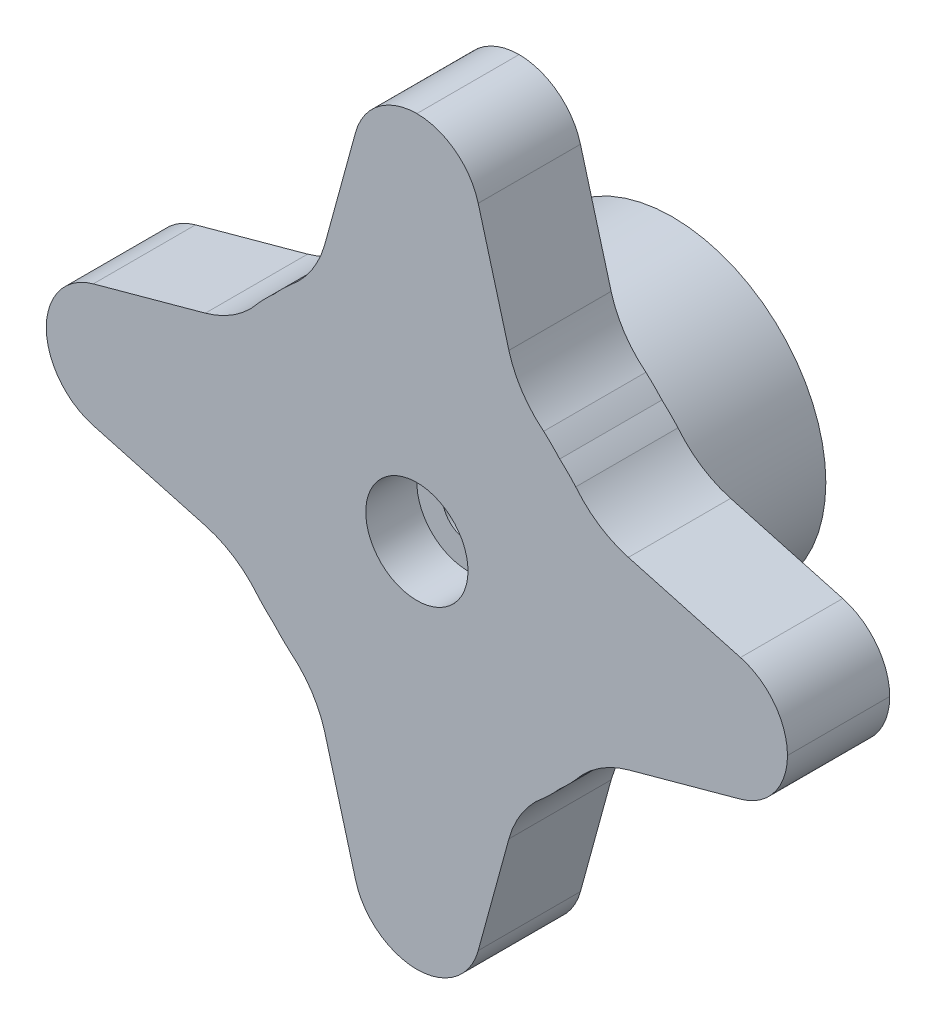
from build123d import *

# Parameters (mm, degrees)
BOSS_EXTRUDE1_DEPTH = 2
SKETCH2_R           = 3
SKETCH2_R_2         = 2.5
BOSS_EXTRUDE2_DEPTH = 3
SKETCH3_R           = 1
CUT_EXTRUDE1_DEPTH  = 1
SKETCH4_R           = 0.5
CUT_EXTRUDE2_DEPTH  = 1


with BuildPart() as part:
    # Sketch1 → Boss-Extrude1 (new body)
    with BuildSketch(Plane.XY):
        with BuildLine():
            Line((1.2, -6.33), (1.8, -4.1378116))
            ThreePointArc((1.8, -4.1378116), (2.058560194, -3.569045514), (2.48, -3.1078116))
            ThreePointArc((2.48, -3.1078116), (2.641475661, -2.955390865), (2.794244497, -2.794244497))
            ThreePointArc((2.794244497, -2.794244497), (2.955390865, -2.641475661), (3.1078116, -2.48))
            ThreePointArc((3.1078116, -2.48), (3.569045514, -2.058560194), (4.1378116, -1.8))
            Line((4.1378116, -1.8), (6.33, -1.2))
            ThreePointArc((6.33, -1.2), (6.992020752, -0.754882576), (7.25, 0))
            ThreePointArc((7.25, 0), (6.992020752, 0.754882576), (6.33, 1.2))
            Line((6.33, 1.2), (4.1378116, 1.8))
            ThreePointArc((4.1378116, 1.8), (3.569045514, 2.058560194), (3.1078116, 2.48))
            ThreePointArc((3.1078116, 2.48), (2.955390865, 2.641475661), (2.794244497, 2.794244497))
            ThreePointArc((2.794244497, 2.794244497), (2.641475661, 2.955390865), (2.48, 3.1078116))
            ThreePointArc((2.48, 3.1078116), (2.058560194, 3.569045514), (1.8, 4.1378116))
            Line((1.8, 4.1378116), (1.2, 6.33))
            ThreePointArc((1.2, 6.33), (0.754882576, 6.992020752), (0, 7.25))
            ThreePointArc((0, 7.25), (-0.754882576, 6.992020752), (-1.2, 6.33))
            Line((-1.2, 6.33), (-1.8, 4.1378116))
            ThreePointArc((-1.8, 4.1378116), (-2.058560194, 3.569045514), (-2.48, 3.1078116))
            ThreePointArc((-2.48, 3.1078116), (-2.641475661, 2.955390865), (-2.794244497, 2.794244497))
            ThreePointArc((-2.794244497, 2.794244497), (-2.955390865, 2.641475661), (-3.1078116, 2.48))
            ThreePointArc((-3.1078116, 2.48), (-3.569045514, 2.058560194), (-4.1378116, 1.8))
            Line((-4.1378116, 1.8), (-6.33, 1.2))
            ThreePointArc((-6.33, 1.2), (-6.992020752, 0.754882576), (-7.25, 0))
            ThreePointArc((-7.25, 0), (-6.992020752, -0.754882576), (-6.33, -1.2))
            Line((-6.33, -1.2), (-4.1378116, -1.8))
            ThreePointArc((-4.1378116, -1.8), (-3.569045514, -2.058560194), (-3.1078116, -2.48))
            ThreePointArc((-3.1078116, -2.48), (-2.955390865, -2.641475661), (-2.794244497, -2.794244497))
            ThreePointArc((-2.794244497, -2.794244497), (-2.641475661, -2.955390865), (-2.48, -3.1078116))
            ThreePointArc((-2.48, -3.1078116), (-2.058560194, -3.569045514), (-1.8, -4.1378116))
            Line((-1.8, -4.1378116), (-1.2, -6.33))
            ThreePointArc((-1.2, -6.33), (-0.754882576, -6.992020752), (0, -7.25))
            ThreePointArc((0, -7.25), (0.754882576, -6.992020752), (1.2, -6.33))
        make_face()
    extrude(amount=BOSS_EXTRUDE1_DEPTH)

    # Sketch2 → Boss-Extrude2 (add)
    with BuildSketch(Plane(origin=(0, 0, 0), x_dir=(-1, 0, 0), z_dir=(0, 0, -1))):
        Circle(SKETCH2_R)
        Circle(SKETCH2_R_2, mode=Mode.SUBTRACT)
    extrude(amount=BOSS_EXTRUDE2_DEPTH)

    # Sketch3 → Cut-Extrude1 (cut)
    with BuildSketch(Plane.XY.offset(2)):
        Circle(SKETCH3_R)
    extrude(amount=-CUT_EXTRUDE1_DEPTH, mode=Mode.SUBTRACT)

    # Sketch4 → Cut-Extrude2 (cut)
    with BuildSketch(Plane.XY.offset(1)):
        Circle(SKETCH4_R)
    extrude(amount=-CUT_EXTRUDE2_DEPTH, mode=Mode.SUBTRACT)


solid = part.part
